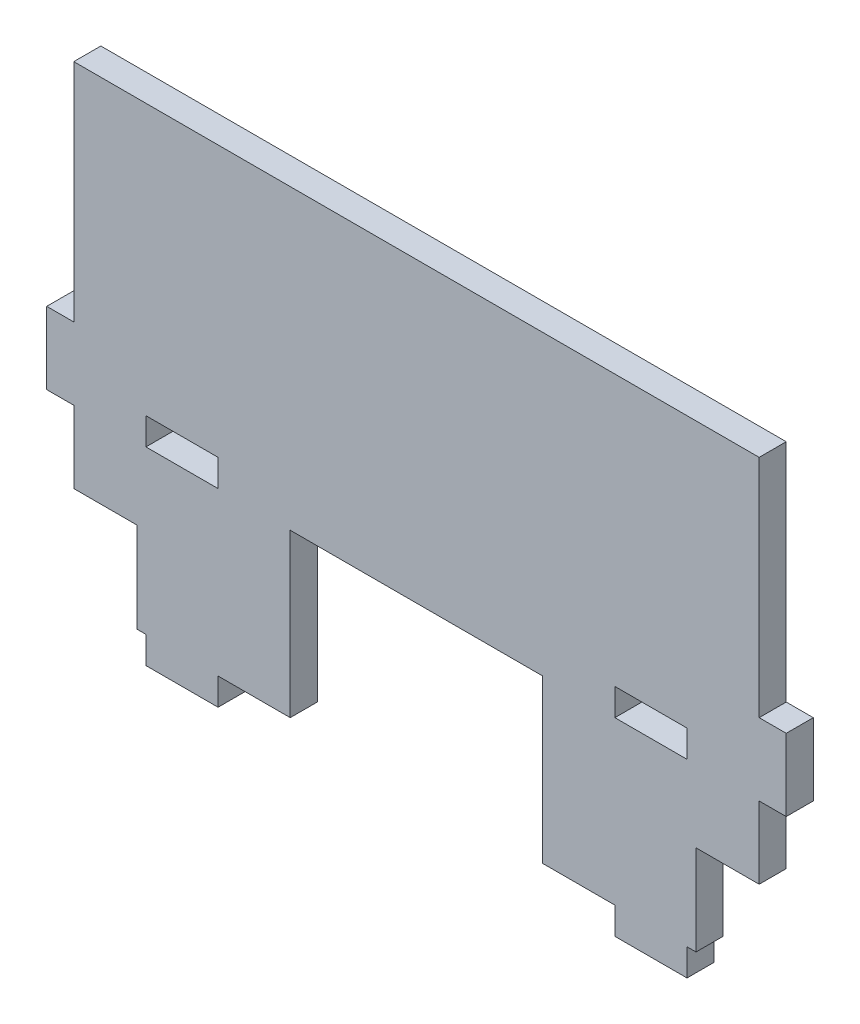
from build123d import *

# Parameters (mm, degrees)
SKETCH_1_W      = 8
SKETCH_1_H      = 3
EXTRUDE_1_DEPTH = 3


with BuildPart() as part:
    # 草图1 → 凸台-拉伸1 (new body)
    with BuildSketch(Plane.XY):
        Polygon((38, 0), (-38, 0), (-38, -25), (-41, -25), (-41, -33), (-38, -33), (-38, -41), (-31, -41), (-31, -51), (-30, -51), (-30, -54), (-22, -54), (-22, -51), (-14, -51), (-14, -33), (14, -33), (14, -51), (22, -51), (22, -54), (30, -54), (30, -51), (31, -51), (31, -41), (38, -41), (38, -33), (41, -33), (41, -25), (38, -25), align=None)
        with Locations((26, -31.5)):
            Rectangle(SKETCH_1_W, SKETCH_1_H, mode=Mode.SUBTRACT)
        with Locations((-26, -31.5)):
            Rectangle(SKETCH_1_W, SKETCH_1_H, mode=Mode.SUBTRACT)
    extrude(amount=EXTRUDE_1_DEPTH)


solid = part.part
